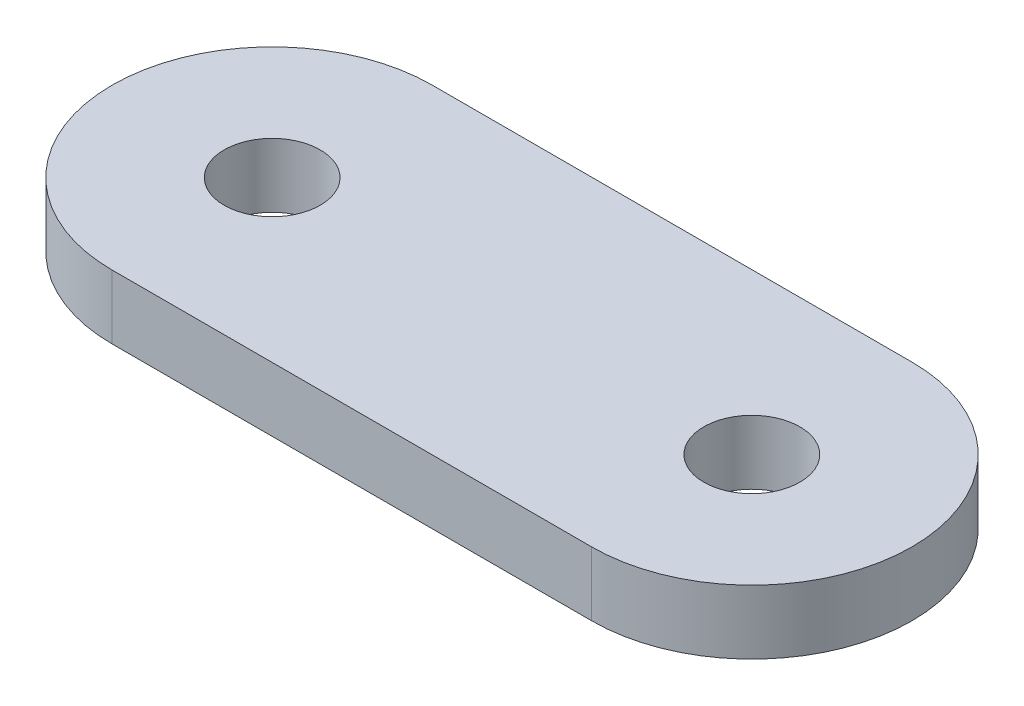
from build123d import *

# Parameters (mm, degrees)
SKETCH1_R           = 1.5
BOSS_EXTRUDE1_DEPTH = 2


with BuildPart() as part:
    # Sketch1 → Boss-Extrude1 (new body)
    with BuildSketch(Plane(origin=(0, 0, 0), x_dir=(1, 0, 0), z_dir=(0, 1, 0))):
        with BuildLine():
            Line((-7.49, 5), (7.49, 5))
            ThreePointArc((7.49, 5), (12.49, 0), (7.49, -5))
            Line((7.49, -5), (-7.49, -5))
            ThreePointArc((-7.49, -5), (-12.49, 0), (-7.49, 5))
        make_face()
        with Locations(Location((7.49, 0, 0), (0, 0, 270))):
            Circle(SKETCH1_R, mode=Mode.SUBTRACT)
        with Locations(Location((-7.49, 0, 0), (0, 0, 270))):
            Circle(SKETCH1_R, mode=Mode.SUBTRACT)
    extrude(amount=BOSS_EXTRUDE1_DEPTH)


solid = part.part
